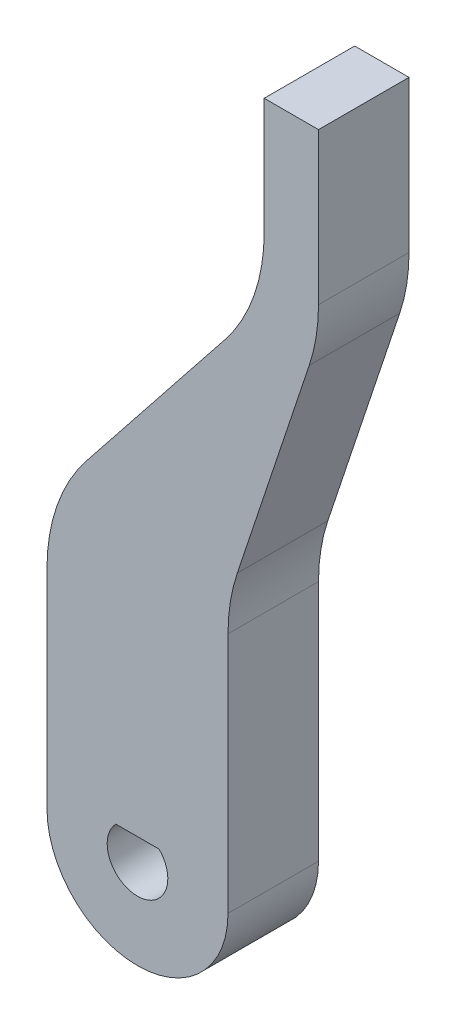
from build123d import *

# Parameters (mm, degrees)
BOSS_EXTRUDE1_DEPTH = 5
FILLET1_R           = 10
FILLET2_R           = 10


with BuildPart() as part:
    # Sketch1 → Boss-Extrude1 (new body)
    with BuildSketch(Plane.XY):
        with BuildLine():
            Line((-5, 0), (-5, 15))
            Line((-5, 15), (7, 30.096250941))
            Line((7, 30.096250941), (7, 40))
            Line((7, 40), (10, 40))
            Line((10, 40), (10, 30))
            Line((10, 30), (5, 15))
            Line((5, 15), (5, 0))
            ThreePointArc((5, 0), (0, -5), (-5, 0))
        make_face()
        with BuildLine():
            Line((-1.193733639, 1.175), (1.193733639, 1.175))
            ThreePointArc((1.193733639, 1.175), (0, -1.675), (-1.193733639, 1.175))
        make_face(mode=Mode.SUBTRACT)
    extrude(amount=BOSS_EXTRUDE1_DEPTH)

    # Fillet1
    fillet1_edges = [part.edges().sort_by_distance(p)[0] for p in [
        (-5, 15, 2.5),
        (10, 30, 2.5),
    ]]
    fillet(fillet1_edges, radius=FILLET1_R)

    # Fillet2
    fillet2_edges = [part.edges().sort_by_distance(p)[0] for p in [
        (7, 30.096250941, 2.5),
        (5, 15, 2.5),
    ]]
    fillet(fillet2_edges, radius=FILLET2_R)


solid = part.part
